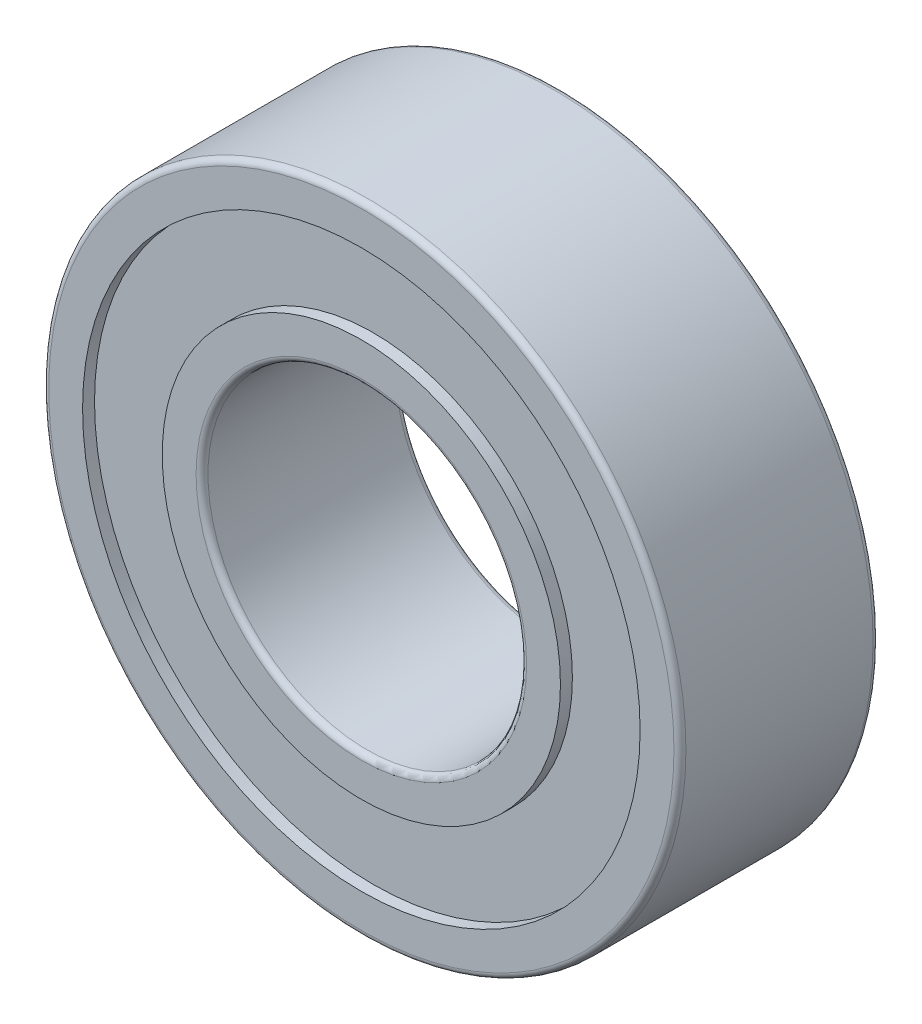
from build123d import *

# Parameters (mm, degrees)
SKETCH1_R           = 8
SKETCH1_R_2         = 4
BOSS_EXTRUDE1_DEPTH = 5
SKETCH2_R           = 7
SKETCH2_R_2         = 5
CUT_EXTRUDE1_DEPTH  = 0.3
CUT_EXTRUDE2_START  = -4.5
SKETCH2_2_R         = 7
SKETCH2_2_R_2       = 5
CUT_EXTRUDE2_DEPTH  = 0.5
FILLET1_R           = 0.15


with BuildPart() as part:
    # Sketch1 → Boss-Extrude1 (new body)
    with BuildSketch(Plane.XY):
        Circle(SKETCH1_R)
        Circle(SKETCH1_R_2, mode=Mode.SUBTRACT)
    extrude(amount=BOSS_EXTRUDE1_DEPTH)

    # Sketch2 → Cut-Extrude1 (cut)
    with BuildSketch(Plane.XY.offset(5)):
        Circle(SKETCH2_R)
        Circle(SKETCH2_R_2, mode=Mode.SUBTRACT)
    extrude(amount=-CUT_EXTRUDE1_DEPTH, mode=Mode.SUBTRACT)

    # Sketch2<2> → Cut-Extrude2 (cut)
    with BuildSketch(Plane.XY.offset(5).offset(CUT_EXTRUDE2_START)):
        Circle(SKETCH2_2_R)
        Circle(SKETCH2_2_R_2, mode=Mode.SUBTRACT)
    extrude(amount=-CUT_EXTRUDE2_DEPTH, mode=Mode.SUBTRACT)

    # Fillet1
    fillet1_edges = [part.edges().sort_by_distance(p)[0] for p in [
        (-8, 0, 0),
        (-8, 0, 5),
        (-4, 0, 0),
        (-4, 0, 5),
    ]]
    fillet(fillet1_edges, radius=FILLET1_R)


solid = part.part
